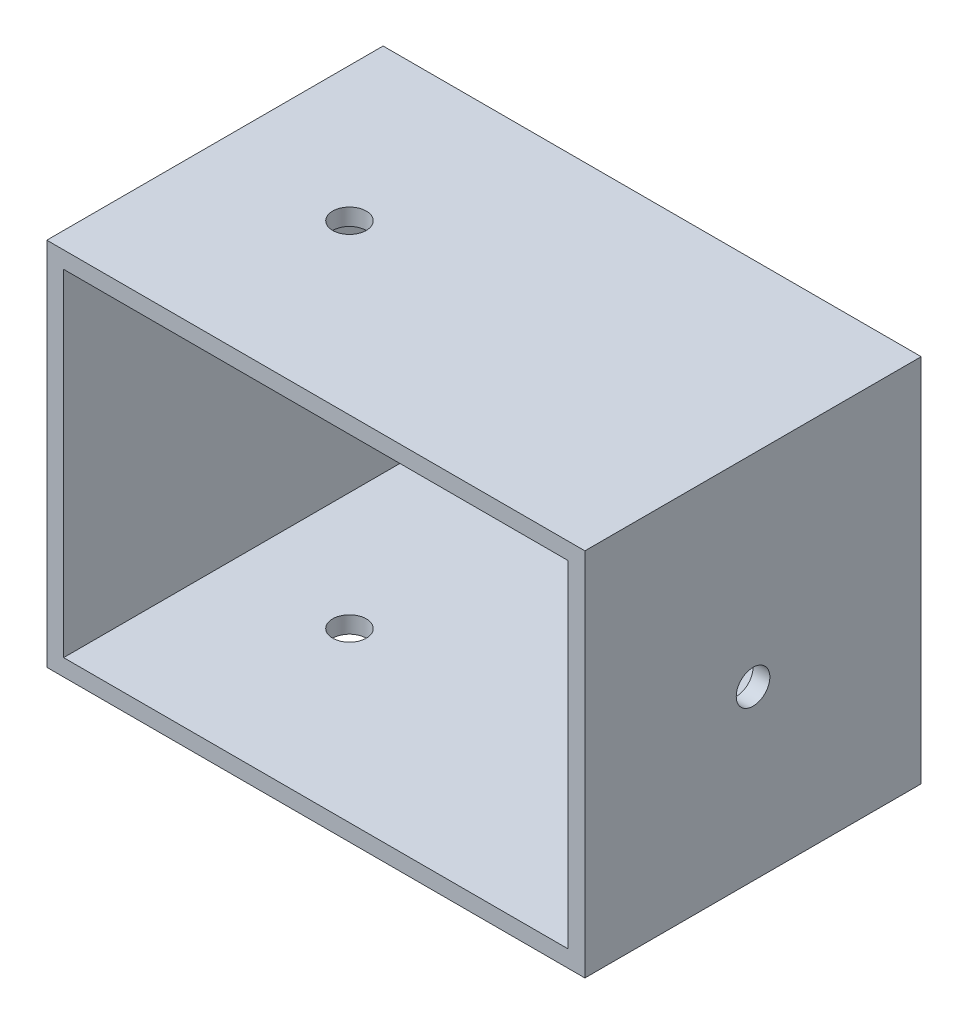
from build123d import *

# Parameters (mm, degrees)
SKETCH1_W           = 160
SKETCH1_H           = 110
SKETCH1_W_2         = 150
SKETCH1_H_2         = 100
BOSS_EXTRUDE1_DEPTH = 100
SKETCH2_R           = 5
CUT_EXTRUDE1_DEPTH  = 240
SKETCH3_R           = 5
CUT_EXTRUDE2_DEPTH  = 10


with BuildPart() as part:
    # Sketch1 → Boss-Extrude1 (new body)
    with BuildSketch(Plane.XY):
        with Locations((80, -55)):
            Rectangle(SKETCH1_W, SKETCH1_H)
        with Locations((80, -55)):
            Rectangle(SKETCH1_W_2, SKETCH1_H_2, mode=Mode.SUBTRACT)
    extrude(amount=BOSS_EXTRUDE1_DEPTH)

    # Sketch2 → Cut-Extrude1 (cut)
    with BuildSketch(Plane.XZ.offset(110)):
        with Locations(Location((40, 50, 0), (0, 0, 270))):
            Circle(SKETCH2_R)
    extrude(amount=-CUT_EXTRUDE1_DEPTH, mode=Mode.SUBTRACT)

    # Sketch3 → Cut-Extrude2 (cut)
    with BuildSketch(Plane(origin=(160, 0, 0), x_dir=(0, 0, -1), z_dir=(1, 0, 0))):
        with Locations(Location((-50, -60, 0), (0, 0, 90))):
            Circle(SKETCH3_R)
    extrude(amount=-CUT_EXTRUDE2_DEPTH, mode=Mode.SUBTRACT)


solid = part.part
